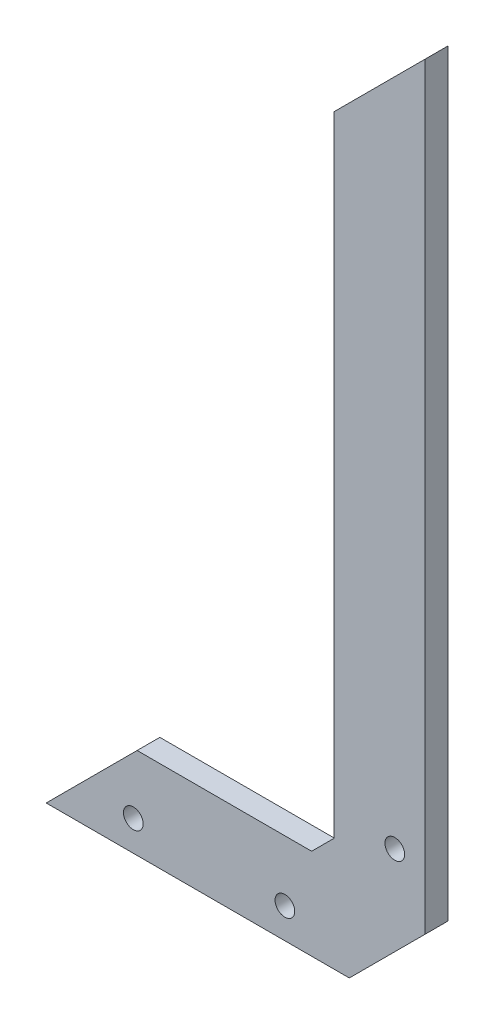
from build123d import *

# Parameters (mm, degrees)
SKETCH1_R      = 1.3
EXTRUDE1_DEPTH = 3


with BuildPart() as part:
    # Sketch1 → Extrude1 (new body)
    with BuildSketch(Plane.XY):
        Polygon((4.5, 10.243545781), (44.5, 10.243545781), (54.5, 20.243545781), (54.5, 120.243545781), (42.5, 108.243545781), (42.5, 25.214108529), (39.529437252, 22.243545781), (16.5, 22.243545781), align=None)
        with Locations((16, 14.243545781)):
            Circle(SKETCH1_R, mode=Mode.SUBTRACT)
        with Locations((36, 14.243545781)):
            Circle(SKETCH1_R, mode=Mode.SUBTRACT)
        with Locations((50.5, 28.003545781)):
            Circle(SKETCH1_R, mode=Mode.SUBTRACT)
    extrude(amount=EXTRUDE1_DEPTH)


solid = part.part
